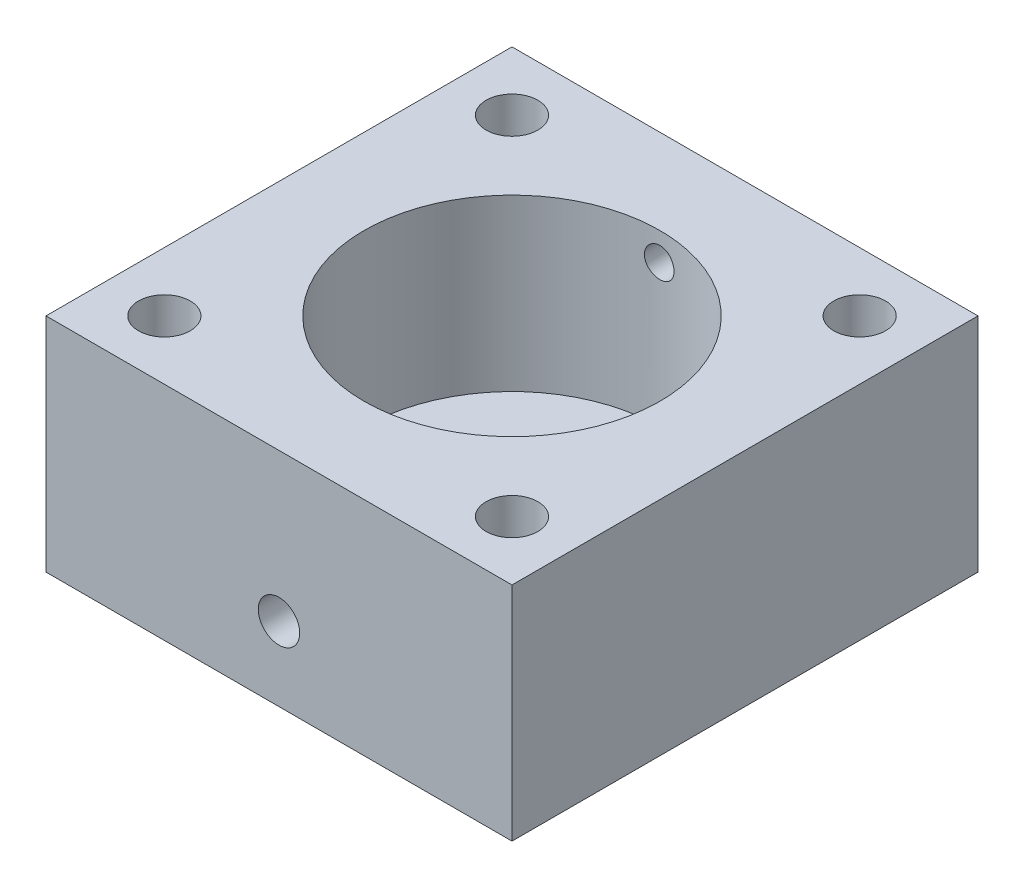
from build123d import *

# Parameters (mm, degrees)
CROQUIS1_W                 = 31.5
CROQUIS1_H                 = 31.5
SALIENTE_EXTRUIR1_DEPTH    = 15
CROQUIS3_R                 = 10
CORTAR_EXTRUIR1_DEPTH      = 11.5
CROQUIS6_R                 = 1.75
CORTAR_EXTRUIR2_DEPTH      = 27.853770685
CORTAR_EXTRUIR3_REACH      = 40.279
CORTAR_EXTRUIR3_END_RADIUS = 10
CROQUIS7_R                 = 1
CORTAR_EXTRUIR4_REACH      = 40.279
CORTAR_EXTRUIR4_END_RADIUS = 10
CROQUIS8_R                 = 1
CROQUIS9_R                 = 1.4
CORTAR_EXTRUIR5_DEPTH      = 2.5
CROQUIS10_R                = 1.4
CORTAR_EXTRUIR6_DEPTH      = 2.5


with BuildPart() as part:
    # Croquis1 → Saliente-Extruir1 (new body)
    with BuildSketch(Plane(origin=(0, 0, 0), x_dir=(1, 0, 0), z_dir=(0, 1, 0))):
        Rectangle(CROQUIS1_W, CROQUIS1_H)
    extrude(amount=SALIENTE_EXTRUIR1_DEPTH)

    # Croquis3 → Cortar-Extruir1 (cut)
    with BuildSketch(Plane(origin=(0, 15, 0), x_dir=(1, 0, 0), z_dir=(0, 1, 0))):
        with Locations(Location((0, 0, 0), (0, 0, 270))):
            Circle(CROQUIS3_R)
    extrude(amount=-CORTAR_EXTRUIR1_DEPTH, mode=Mode.SUBTRACT)

    # Croquis6 → Cortar-Extruir2 (cut, through all)
    with BuildSketch(Plane(origin=(0, 15, 0), x_dir=(1, 0, 0), z_dir=(0, 1, 0))):
        with Locations(Location((-11.75, -11.75, 0), (0, 0, 270))):
            Circle(CROQUIS6_R)
        with Locations(Location((11.75, -11.75, 0), (0, 0, 90))):
            Circle(CROQUIS6_R)
        with Locations(Location((11.75, 11.75, 0), (0, 0, 270))):
            Circle(CROQUIS6_R)
        with Locations(Location((-11.75, 11.75, 0), (0, 0, 90))):
            Circle(CROQUIS6_R)
    extrude(amount=-CORTAR_EXTRUIR2_DEPTH, mode=Mode.SUBTRACT)

    # Cortar-Extruir3: up to this cylinder (the profile starts outside it)
    cortar_extruir3_end = Plane(origin=(0, 5, 0), z_dir=(0, 1, 0)) * Cylinder(CORTAR_EXTRUIR3_END_RADIUS, 101.558, mode=Mode.PRIVATE)
    # Croquis7 → Cortar-Extruir3 (cut, up to the surface)
    with BuildSketch(Plane.XY.offset(15.75), mode=Mode.PRIVATE) as cortar_extruir3_sk1:
        with Locations((0, 5)):
            Circle(CROQUIS7_R)
    cortar_extruir3_tool1 = extrude(cortar_extruir3_sk1.sketch, amount=-CORTAR_EXTRUIR3_REACH, mode=Mode.PRIVATE) - cortar_extruir3_end
    add(cortar_extruir3_tool1.solids().sort_by_distance((0, 5, 15.75))[0], mode=Mode.SUBTRACT)

    # Cortar-Extruir4: up to this cylinder (the profile starts outside it)
    cortar_extruir4_end = Plane(origin=(0, 13.123683, 0), z_dir=(0, 1, 0)) * Cylinder(CORTAR_EXTRUIR4_END_RADIUS, 101.558, mode=Mode.PRIVATE)
    # Croquis8 → Cortar-Extruir4 (cut, up to the surface)
    with BuildSketch(Plane(origin=(0, 0, -15.75), x_dir=(-1, 0, 0), z_dir=(0, 0, -1)), mode=Mode.PRIVATE) as cortar_extruir4_sk1:
        with Locations((0, 13.123683267)):
            Circle(CROQUIS8_R)
    cortar_extruir4_tool1 = extrude(cortar_extruir4_sk1.sketch, amount=-CORTAR_EXTRUIR4_REACH, mode=Mode.PRIVATE) - cortar_extruir4_end
    add(cortar_extruir4_tool1.solids().sort_by_distance((0, 13.123683, -15.75))[0], mode=Mode.SUBTRACT)

    # Croquis9 → Cortar-Extruir5 (cut)
    with BuildSketch(Plane.XY.offset(15.75)):
        with Locations((0, 5)):
            Circle(CROQUIS9_R)
    extrude(amount=-CORTAR_EXTRUIR5_DEPTH, mode=Mode.SUBTRACT)

    # Croquis10 → Cortar-Extruir6 (cut)
    with BuildSketch(Plane(origin=(0, 0, -15.75), x_dir=(-1, 0, 0), z_dir=(0, 0, -1))):
        with Locations((0, 13.123683267)):
            Circle(CROQUIS10_R)
    extrude(amount=-CORTAR_EXTRUIR6_DEPTH, mode=Mode.SUBTRACT)


solid = part.part
